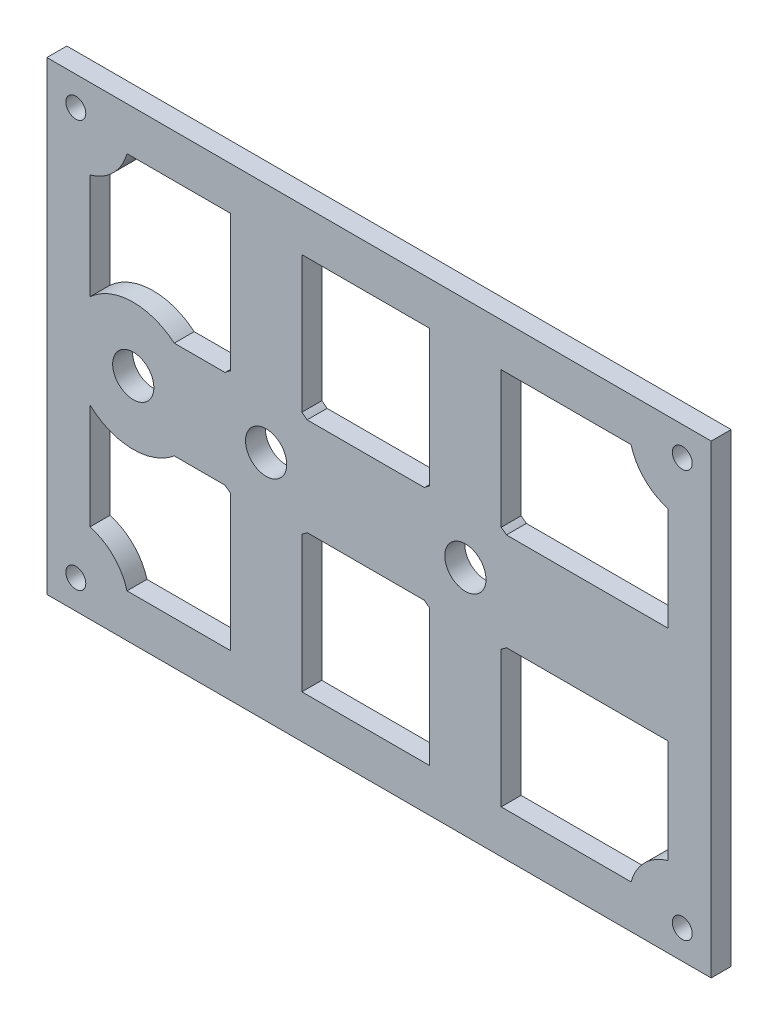
from build123d import *

# Parameters (mm, degrees)
SKETCH1_W               = 100
SKETCH1_H               = 70
BOSS_EXTRUDE1_DEPTH     = 3
SKETCH2_R               = 3.1
CUT_EXTRUDE1_DEPTH      = 62.10646447
SKETCH3_R               = 1.5
CUT_EXTRUDE2_DEPTH      = 62.10646447
MIRROR2_COPY_1_SKETCH_R = 1.5
MIRROR2_COPY_1_DEPTH    = 62.10646447
CUT_EXTRUDE3_DEPTH      = 62.10646447


with BuildPart() as part:
    # Sketch1 → Boss-Extrude1 (new body)
    with BuildSketch(Plane.XY):
        Rectangle(SKETCH1_W, SKETCH1_H)
    extrude(amount=BOSS_EXTRUDE1_DEPTH)

    # Sketch2 → Cut-Extrude1 (cut, through all)
    with BuildSketch(Plane.XY.offset(3)):
        with Locations((-17, 0)):
            Circle(SKETCH2_R)
        with Locations((-37, 0)):
            Circle(SKETCH2_R)
        with Locations((13, 0)):
            Circle(SKETCH2_R)
    extrude(amount=-CUT_EXTRUDE1_DEPTH, mode=Mode.SUBTRACT)

    # Sketch3 → Cut-Extrude2 (cut, through all)
    with BuildSketch(Plane.XY.offset(3)):
        with Locations((-45.644550594, 30.644550594)):
            Circle(SKETCH3_R)
    cut_extrude2 = extrude(amount=-CUT_EXTRUDE2_DEPTH, mode=Mode.SUBTRACT)

    # Mirror1: Cut-Extrude2 across plane
    add(cut_extrude2.mirror(Plane(origin=(0, 0, 0), x_dir=(0, 0, 1), z_dir=(1, 0, 0))), mode=Mode.SUBTRACT)

    # Mirror2: Cut-Extrude2 across plane
    add(cut_extrude2.mirror(Plane.ZX), mode=Mode.SUBTRACT)

    # Mirror2 copy 1 sketch → Mirror2 copy 1 (cut, through all)
    with BuildSketch(Plane(origin=(0, 0, 3), x_dir=(-1, 0, 0), z_dir=(0, 0, 1))):
        with Locations((-45.644550594, 30.644550594)):
            Circle(MIRROR2_COPY_1_SKETCH_R)
    extrude(amount=-MIRROR2_COPY_1_DEPTH, mode=Mode.SUBTRACT)

    # Sketch4 → Cut-Extrude3 (cut, through all)
    with BuildSketch(Plane.XY.offset(3)):
        with BuildLine():
            Line((7.613447212, 28.5), (-11.613447212, 28.5))
            Line((-11.613447212, 28.5), (-11.613447212, 7.946385912))
            ThreePointArc((-11.613447212, 7.946385912), (-11.211126909, 7.658260137), (-10.824188204, 7.34978562))
            Line((-10.824188204, 7.34978562), (6.824188204, 7.34978562))
            ThreePointArc((6.824188204, 7.34978562), (7.211126909, 7.658260137), (7.613447212, 7.946385912))
            Line((7.613447212, 7.946385912), (7.613447212, 28.5))
        make_face()
        with BuildLine():
            Line((43.5, 7.34978562), (43.5, 22.937352481))
            ThreePointArc((43.5, 22.937352481), (39.987696344, 24.987696344), (37.937352481, 28.5))
            Line((37.937352481, 28.5), (18.386552788, 28.5))
            Line((18.386552788, 28.5), (18.386552788, 7.946385912))
            ThreePointArc((18.386552788, 7.946385912), (18.788873091, 7.658260137), (19.175811796, 7.34978562))
            Line((19.175811796, 7.34978562), (43.5, 7.34978562))
        make_face()
        with BuildLine():
            Line((19.175811796, -7.34978562), (43.5, -7.34978562))
            Line((43.5, -7.34978562), (43.5, -22.937352481))
            ThreePointArc((43.5, -22.937352481), (39.987696344, -24.987696344), (37.937352481, -28.5))
            Line((37.937352481, -28.5), (18.386552788, -28.5))
            Line((18.386552788, -28.5), (18.386552788, -7.946385912))
            ThreePointArc((18.386552788, -7.946385912), (18.788873091, -7.658260137), (19.175811796, -7.34978562))
        make_face()
        with BuildLine():
            Line((-22.386552788, 28.5), (-37.937352481, 28.5))
            ThreePointArc((-37.937352481, 28.5), (-39.987696344, 24.987696344), (-43.5, 22.937352481))
            Line((-43.5, 22.937352481), (-43.5, 7.064700984))
            ThreePointArc((-43.5, 7.064700984), (-37.215853678, 9.597572984), (-30.824188204, 7.34978562))
            Line((-30.824188204, 7.34978562), (-23.175811796, 7.34978562))
            ThreePointArc((-23.175811796, 7.34978562), (-22.788873091, 7.658260137), (-22.386552788, 7.946385912))
            Line((-22.386552788, 7.946385912), (-22.386552788, 28.5))
        make_face()
        with BuildLine():
            Line((-37.937352481, -28.5), (-22.386552788, -28.5))
            Line((-22.386552788, -28.5), (-22.386552788, -7.946385912))
            ThreePointArc((-22.386552788, -7.946385912), (-22.788873091, -7.658260137), (-23.175811796, -7.34978562))
            Line((-23.175811796, -7.34978562), (-30.824188204, -7.34978562))
            ThreePointArc((-30.824188204, -7.34978562), (-37.215853678, -9.597572984), (-43.5, -7.064700984))
            Line((-43.5, -7.064700984), (-43.5, -22.937352481))
            ThreePointArc((-43.5, -22.937352481), (-39.987696344, -24.987696344), (-37.937352481, -28.5))
        make_face()
        with BuildLine():
            Line((-11.613447212, -28.5), (7.613447212, -28.5))
            Line((7.613447212, -28.5), (7.613447212, -7.946385912))
            ThreePointArc((7.613447212, -7.946385912), (7.211126909, -7.658260137), (6.824188204, -7.34978562))
            Line((6.824188204, -7.34978562), (-10.824188204, -7.34978562))
            ThreePointArc((-10.824188204, -7.34978562), (-11.211126909, -7.658260137), (-11.613447212, -7.946385912))
            Line((-11.613447212, -7.946385912), (-11.613447212, -28.5))
        make_face()
    extrude(amount=-CUT_EXTRUDE3_DEPTH, mode=Mode.SUBTRACT)


solid = part.part
